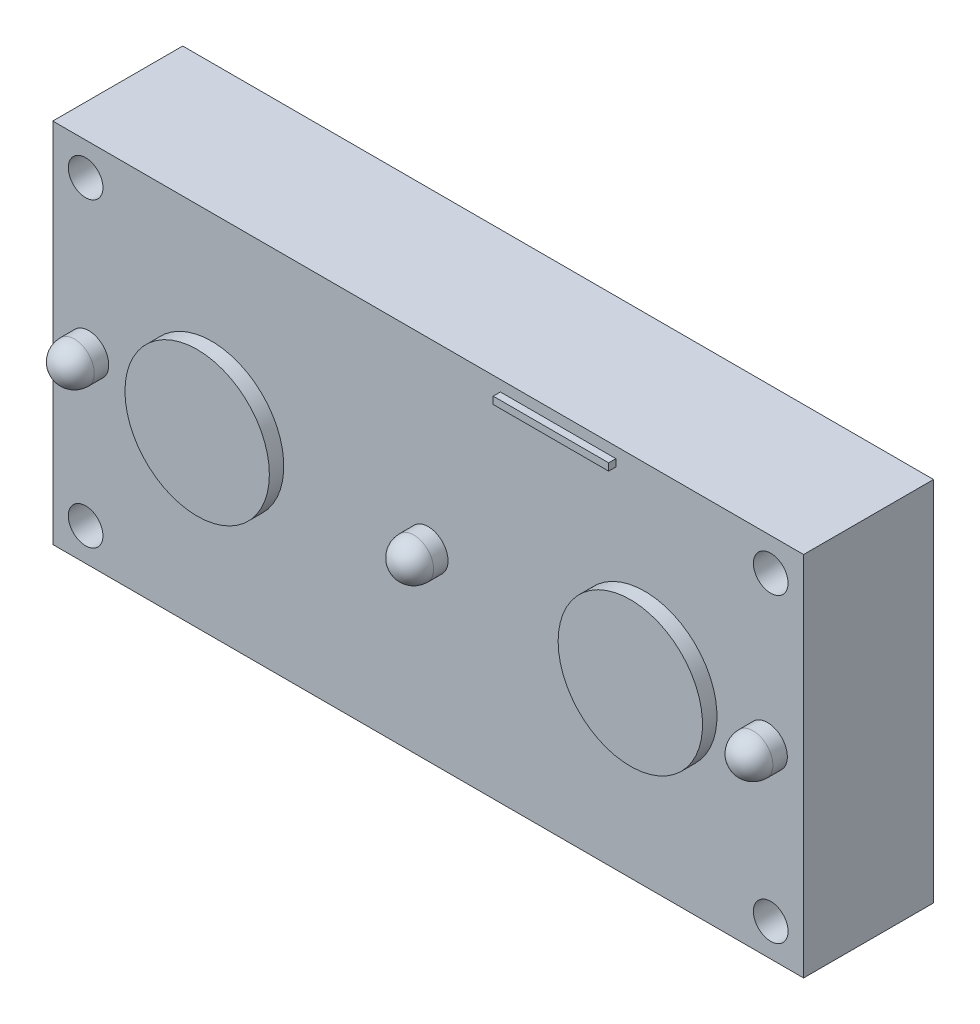
from build123d import *

# Parameters (mm, degrees)
SCHIZZO1_W                   = 52
SCHIZZO1_H                   = 25.4
ESTRUSIONE_ESTRUSIONE1_DEPTH = 9
FORO_PER_VITE_M2_1_D         = 2.4
SCHIZZO5_R                   = 5
ESTRUSIONE_ESTRUSIONE2_DEPTH = 1
SCHIZZO6_W                   = 8
SCHIZZO6_H                   = 0.5
ESTRUSIONE_ESTRUSIONE3_DEPTH = 0.5
SCHIZZO7_R                   = 1.375
ESTRUSIONE_ESTRUSIONE4_DEPTH = 1
CUPOLA1_FACE_RADIUS          = 1.375
CUPOLA1_HEIGHT               = 1.375
CUPOLA2_FACE_RADIUS          = 1.375
CUPOLA2_HEIGHT               = 1.375
CUPOLA3_FACE_RADIUS          = 1.375
CUPOLA3_HEIGHT               = 1.375


with BuildPart() as part:
    # Schizzo1 → Estrusione-Estrusione1 (new body)
    with BuildSketch(Plane.XY):
        Rectangle(SCHIZZO1_W, SCHIZZO1_H)
    extrude(amount=ESTRUSIONE_ESTRUSIONE1_DEPTH)

    # Foro per Vite M2-1 (through all)
    with Locations(Plane.XY.offset(9)):
        with Locations((-23.725, 10.44), (-23.725, -10.44), (23.725, -10.44), (23.725, 10.44)):
            Hole(FORO_PER_VITE_M2_1_D / 2)

    # Schizzo5 → Estrusione-Estrusione2 (add)
    with BuildSketch(Plane.XY.offset(9)):
        with Locations(Location((-15, 0, 0), (0, 0, 180))):
            Circle(SCHIZZO5_R)
        with Locations(Location((15, 0, 0), (0, 0, 180))):
            Circle(SCHIZZO5_R)
    extrude(amount=ESTRUSIONE_ESTRUSIONE2_DEPTH)

    # Schizzo6 → Estrusione-Estrusione3 (add)
    with BuildSketch(Plane.XY.offset(9)):
        with Locations((9, 11.7)):
            Rectangle(SCHIZZO6_W, SCHIZZO6_H)
    extrude(amount=ESTRUSIONE_ESTRUSIONE3_DEPTH)

    # Schizzo7 → Estrusione-Estrusione4 (add)
    with BuildSketch(Plane.XY.offset(9)):
        with Locations(Location((-23.5, 0, 0), (0, 0, 180))):
            Circle(SCHIZZO7_R)
        with Locations(Location((23.5, 0, 0), (0, 0, 180))):
            Circle(SCHIZZO7_R)
        with Locations(Location((0, 0, 0), (0, 0, 180))):
            Circle(SCHIZZO7_R)
    extrude(amount=ESTRUSIONE_ESTRUSIONE4_DEPTH)

    # Cupola1: a dome of height H over a round flat face of radius A is a cap of a sphere of radius (A * A + H * H) / (2 * H)
    cupola1_r = (CUPOLA1_FACE_RADIUS * CUPOLA1_FACE_RADIUS + CUPOLA1_HEIGHT * CUPOLA1_HEIGHT) / (2 * CUPOLA1_HEIGHT)
    cupola1_base = Plane((-23.5, 0, 10), z_dir=(0, 0, 1))
    with Locations(cupola1_base.offset(CUPOLA1_HEIGHT - cupola1_r)):
        cupola1_ball = Sphere(cupola1_r, mode=Mode.PRIVATE)
    add(split(cupola1_ball, bisect_by=cupola1_base, keep=Keep.TOP, mode=Mode.PRIVATE))

    # Cupola2: a dome of height H over a round flat face of radius A is a cap of a sphere of radius (A * A + H * H) / (2 * H)
    cupola2_r = (CUPOLA2_FACE_RADIUS * CUPOLA2_FACE_RADIUS + CUPOLA2_HEIGHT * CUPOLA2_HEIGHT) / (2 * CUPOLA2_HEIGHT)
    cupola2_base = Plane((0, 0, 10), z_dir=(0, 0, 1))
    with Locations(cupola2_base.offset(CUPOLA2_HEIGHT - cupola2_r)):
        cupola2_ball = Sphere(cupola2_r, mode=Mode.PRIVATE)
    add(split(cupola2_ball, bisect_by=cupola2_base, keep=Keep.TOP, mode=Mode.PRIVATE))

    # Cupola3: a dome of height H over a round flat face of radius A is a cap of a sphere of radius (A * A + H * H) / (2 * H)
    cupola3_r = (CUPOLA3_FACE_RADIUS * CUPOLA3_FACE_RADIUS + CUPOLA3_HEIGHT * CUPOLA3_HEIGHT) / (2 * CUPOLA3_HEIGHT)
    cupola3_base = Plane((23.5, 0, 10), z_dir=(0, 0, 1))
    with Locations(cupola3_base.offset(CUPOLA3_HEIGHT - cupola3_r)):
        cupola3_ball = Sphere(cupola3_r, mode=Mode.PRIVATE)
    add(split(cupola3_ball, bisect_by=cupola3_base, keep=Keep.TOP, mode=Mode.PRIVATE))


solid = part.part
